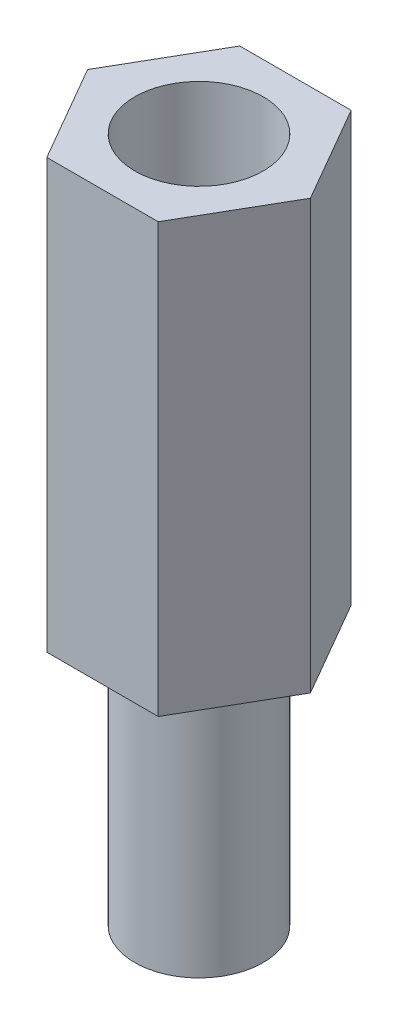
from build123d import *

# Parameters (mm, degrees)
EXTRUDE_2_DEPTH     = 10
SKETCH_2_R          = 1.5
CUT_EXTRUDE_1_DEPTH = 7
SKETCH_3_R          = 1.5
EXTRUDE_3_DEPTH     = 6


with BuildPart() as part:
    # 草图1 → 凸台-拉伸2 (new body)
    with BuildSketch(Plane(origin=(0, 0, 0), x_dir=(1, 0, 0), z_dir=(0, 1, 0))):
        Polygon((2.6, 0), (1.3, 2.25166605), (-1.3, 2.25166605), (-2.6, 0), (-1.3, -2.25166605), (1.3, -2.25166605), align=None)
    extrude(amount=EXTRUDE_2_DEPTH)

    # 草图2 → 切除-拉伸1 (cut)
    with BuildSketch(Plane(origin=(0, 10, 0), x_dir=(1, 0, 0), z_dir=(0, 1, 0))):
        with Locations(Location((0, 0, 0), (0, 0, 270))):
            Circle(SKETCH_2_R)
    extrude(amount=-CUT_EXTRUDE_1_DEPTH, mode=Mode.SUBTRACT)

    # 草图3 → 凸台-拉伸3 (add)
    with BuildSketch(Plane.XZ):
        with Locations(Location((0, 0, 0), (0, 0, 90))):
            Circle(SKETCH_3_R)
    extrude(amount=EXTRUDE_3_DEPTH)


solid = part.part
